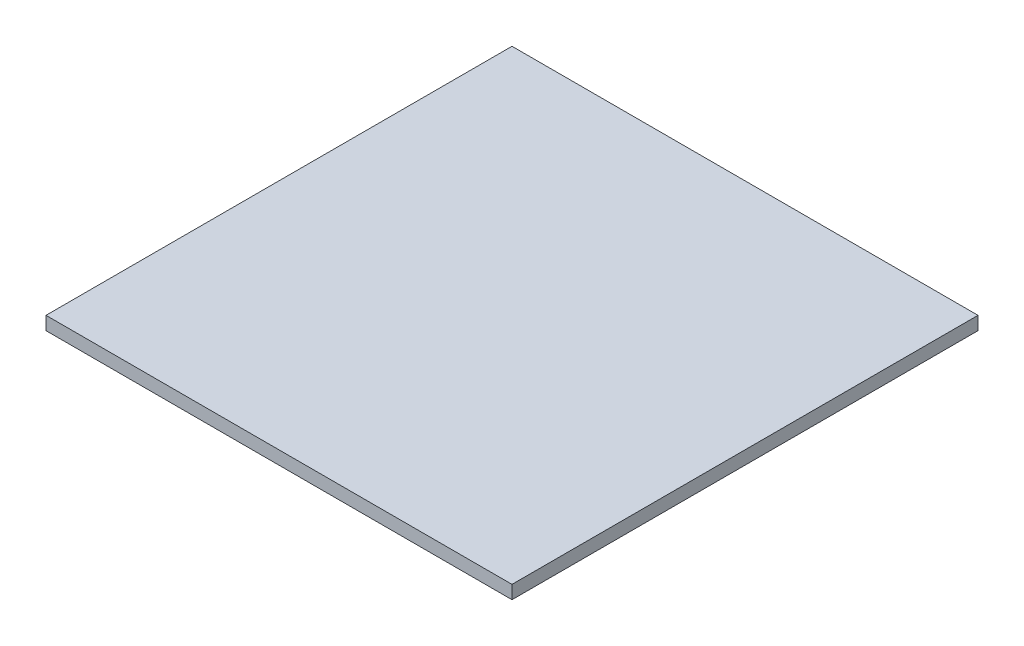
from build123d import *

# Parameters (mm, degrees)
SKETCH1_W           = 14
SKETCH1_H           = 14
BOSS_EXTRUDE1_DEPTH = 0.4


with BuildPart() as part:
    # Sketch1 → Boss-Extrude1 (new body)
    with BuildSketch(Plane(origin=(0, 0, 0), x_dir=(1, 0, 0), z_dir=(0, 1, 0))):
        with Locations((7, 7)):
            Rectangle(SKETCH1_W, SKETCH1_H)
    extrude(amount=BOSS_EXTRUDE1_DEPTH)


solid = part.part
